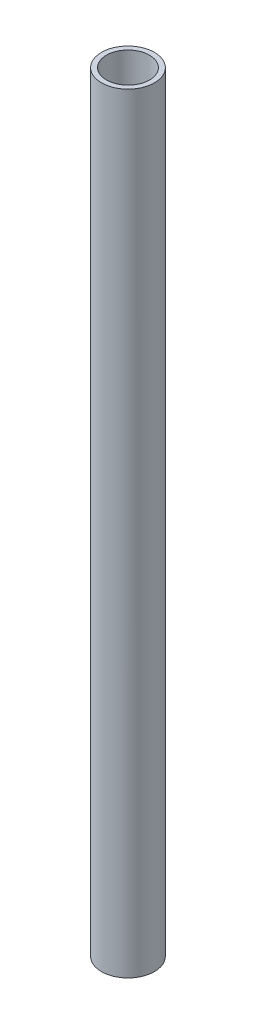
from build123d import *

# Parameters (mm, degrees)
SKETCH1_R           = 7.9375
SKETCH1_R_2         = 6.4643
BOSS_EXTRUDE1_DEPTH = 230.985520837


with BuildPart() as part:
    # Sketch1 → Boss-Extrude1 (new body)
    with BuildSketch(Plane(origin=(0, 0, 0), x_dir=(1, 0, 0), z_dir=(0, 1, 0))):
        with Locations(Location((0, 0, 0), (0, 0, 180))):
            Circle(SKETCH1_R)
        with Locations(Location((0, 0, 0), (0, 0, 180))):
            Circle(SKETCH1_R_2, mode=Mode.SUBTRACT)
    extrude(amount=BOSS_EXTRUDE1_DEPTH)


solid = part.part
